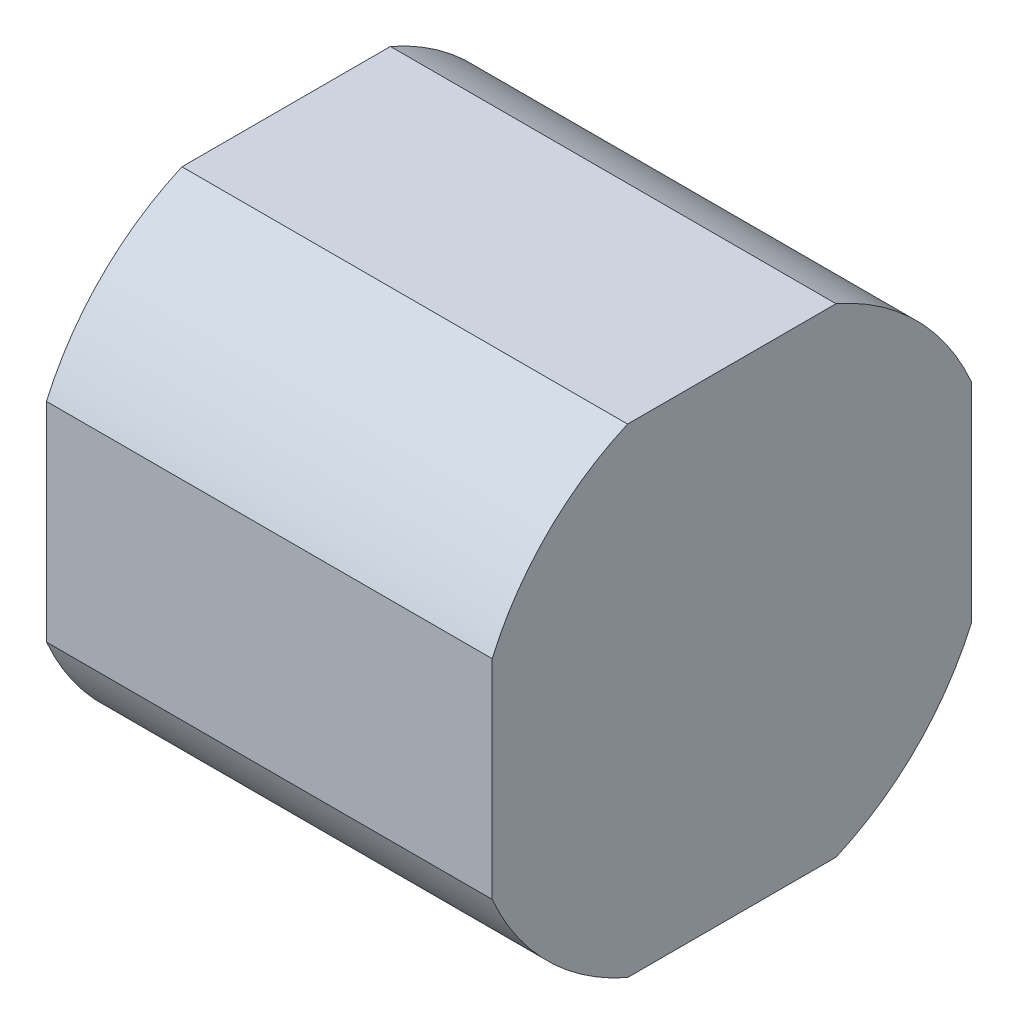
from build123d import *

# Parameters (mm, degrees)
BOSS_EXTRUDE1_DEPTH = 18.5


with BuildPart() as part:
    # Sketch1 → Boss-Extrude1 (new body)
    with BuildSketch(Plane.YZ):
        with BuildLine():
            Line((-4.326661531, 9.95), (4.326661531, 9.95))
            ThreePointArc((4.326661531, 9.95), (7.672108576, 7.672108576), (9.95, 4.326661531))
            Line((9.95, 4.326661531), (9.95, -4.326661531))
            ThreePointArc((9.95, -4.326661531), (7.672108576, -7.672108576), (4.326661531, -9.95))
            Line((4.326661531, -9.95), (-4.326661531, -9.95))
            ThreePointArc((-4.326661531, -9.95), (-7.672108576, -7.672108576), (-9.95, -4.326661531))
            Line((-9.95, -4.326661531), (-9.95, 4.326661531))
            ThreePointArc((-9.95, 4.326661531), (-7.672108576, 7.672108576), (-4.326661531, 9.95))
        make_face()
    extrude(amount=BOSS_EXTRUDE1_DEPTH)


solid = part.part
